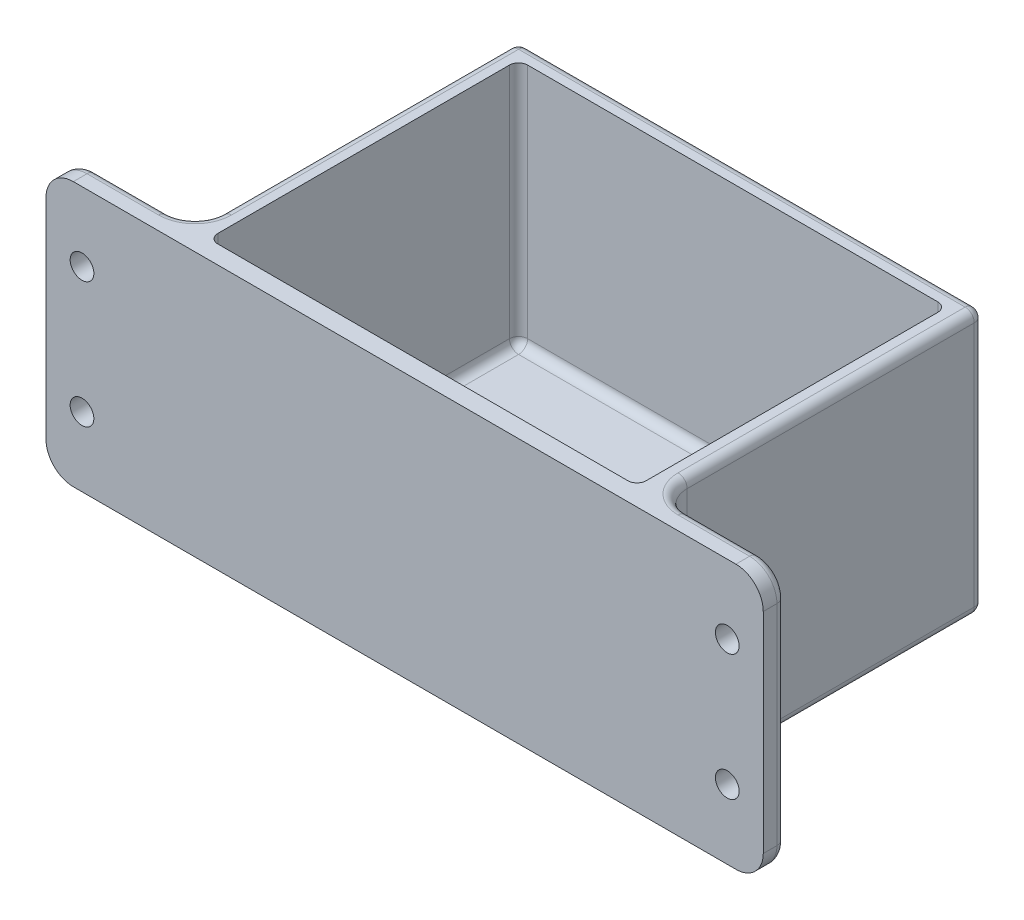
from build123d import *

# Parameters (mm, degrees)
SKETCH1_W           = 129.54
SKETCH1_H           = 96.52
BOSS_EXTRUDE1_DEPTH = 73.66
SKETCH2_W           = 119.38
SKETCH2_H           = 86.36
CUT_EXTRUDE1_DEPTH  = 68.58
FILLET1_R           = 2.54
SKETCH3_W           = 35.179
SKETCH3_H           = 73.66
SKETCH3_R           = 3.302
BOSS_EXTRUDE2_DEPTH = 6.35
FILLET2_R           = 7.62
FILLET3_R           = 7.62
FILLET4_R           = 7.62
FILLET5_R           = 2.54


with BuildPart() as part:
    # Sketch1 → Boss-Extrude1 (new body)
    with BuildSketch(Plane(origin=(0, 0, 0), x_dir=(1, 0, 0), z_dir=(0, 1, 0))):
        Rectangle(SKETCH1_W, SKETCH1_H)
    extrude(amount=BOSS_EXTRUDE1_DEPTH)

    # Sketch2 → Cut-Extrude1 (cut)
    with BuildSketch(Plane(origin=(0, 73.66, 0), x_dir=(1, 0, 0), z_dir=(0, 1, 0))):
        Rectangle(SKETCH2_W, SKETCH2_H)
    extrude(amount=-CUT_EXTRUDE1_DEPTH, mode=Mode.SUBTRACT)

    # Fillet1
    fillet1_edges = [part.edges().sort_by_distance(p)[0] for p in [
        (59.69, 5.08, 0),
        (59.69, 39.37, -43.18),
        (0, 5.08, 43.18),
        (59.69, 39.37, 43.18),
        (-59.69, 5.08, 0),
        (-59.69, 39.37, 43.18),
        (0, 5.08, -43.18),
        (-59.69, 39.37, -43.18),
    ]]
    fillet(fillet1_edges, radius=FILLET1_R)

    # Sketch3 → Boss-Extrude2 (add)
    # profile 1 of 2: a face of its own
    with BuildSketch(Plane.XY.offset(48.26)):
        with Locations((-82.3595, 36.83)):
            Rectangle(SKETCH3_W, SKETCH3_H)
        with Locations((-89.916, 54.356)):
            Circle(SKETCH3_R, mode=Mode.SUBTRACT)
        with Locations(Location((-89.916, 19.304, 0), (0, 0, 180))):
            Circle(SKETCH3_R, mode=Mode.SUBTRACT)
    # profile 2 of 2: a face of its own
    with BuildSketch(Plane.XY.offset(48.26)):
        with Locations((82.3595, 36.83)):
            Rectangle(SKETCH3_W, SKETCH3_H)
        with Locations((89.916, 19.304)):
            Circle(SKETCH3_R, mode=Mode.SUBTRACT)
        with Locations(Location((89.916, 54.356, 0), (0, 0, 180))):
            Circle(SKETCH3_R, mode=Mode.SUBTRACT)
    extrude(amount=-BOSS_EXTRUDE2_DEPTH)

    # Fillet2
    fillet2_edges = [part.edges().sort_by_distance(p)[0] for p in [
        (-64.77, 36.83, 41.91),
        (64.77, 36.83, 41.91),
    ]]
    fillet(fillet2_edges, radius=FILLET2_R)

    # Fillet3
    fillet3_edges = [part.edges().sort_by_distance(p)[0] for p in [
        (-99.949, 73.66, 45.085),
        (-99.949, 0, 45.085),
    ]]
    fillet(fillet3_edges, radius=FILLET3_R)

    # Fillet4
    fillet4_edges = [part.edges().sort_by_distance(p)[0] for p in [
        (99.949, 73.66, 45.085),
        (99.949, 0, 45.085),
    ]]
    fillet(fillet4_edges, radius=FILLET4_R)

    # Fillet5
    fillet5_edges = [part.edges().sort_by_distance(p)[0] for p in [
        (-64.77, 73.66, -6.985),
        (-99.949, 36.83, 41.91),
        (-82.3595, 0, 41.91),
        (-97.717153673, 2.231846327, 41.91),
        (-97.717153673, 71.428153673, 41.91),
        (99.949, 36.83, 41.91),
        (82.3595, 73.66, 41.91),
        (97.717153673, 2.231846327, 41.91),
        (97.717153673, 71.428153673, 41.91),
        (-64.77, 0, -6.985),
        (0, 0, -48.26),
        (0, 73.66, -48.26),
        (-64.77, 36.83, -48.26),
        (64.77, 36.83, -48.26),
        (64.77, 73.66, -6.985),
        (64.77, 0, -6.985),
        (82.3595, 0, 41.91),
        (-82.3595, 73.66, 41.91),
        (67.001846327, 0, 39.678153673),
        (67.001846327, 73.66, 39.678153673),
        (-67.001846327, 73.66, 39.678153673),
        (-67.001846327, 0, 39.678153673),
    ]]
    fillet(fillet5_edges, radius=FILLET5_R)


solid = part.part
